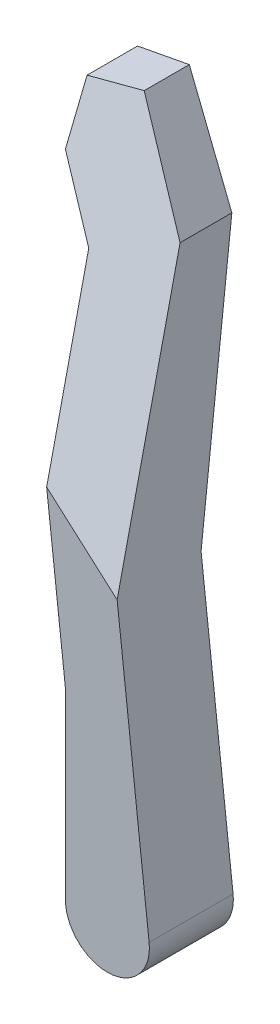
from build123d import *

# Parameters (mm, degrees)
EXTRUDE_START       = -3
EXTRUDE_1_DEPTH     = 8
EXTRUDE_2_DEPTH     = 8
CUT_EXTRUDE_2_DEPTH = 97.54987759


with BuildPart() as part:
    # 草图2 → 凸台-拉伸1 (new body)
    with BuildSketch(Plane.XY.offset(EXTRUDE_START)):
        with BuildLine():
            Line((3.974287423, 0.452812855), (-1.780163155, 50.958977377))
            Line((-1.780163155, 50.958977377), (-7, 60))
            Line((-7, 60), (-11, 60))
            Line((-11, 60), (-11, 54.92820323))
            Line((-11, 54.92820323), (-7.600316475, 49.039778636))
            Line((-7.600316475, 49.039778636), (-4, 17.440206483))
            Line((-4, 17.440206483), (-4, 0))
            ThreePointArc((-4, 0), (0.22677115, -3.993566682), (3.974287423, 0.452812855))
        make_face()
    extrude(amount=-EXTRUDE_1_DEPTH)

    # 草图4 → 凸台-拉伸2 (add)
    with BuildSketch(Plane(origin=(0, 0, -11), x_dir=(-1, 0, 0), z_dir=(0, 0, -1))):
        Polygon((1.780163155, 50.958977377), (-0.926709618, 27.201059955), (5.789070951, 33.142680696), (7.600316475, 49.039778636), (11, 54.92820323), (11, 60), (7, 60), align=None)
    extrude(amount=EXTRUDE_2_DEPTH)

    # 草图5 → 切除-拉伸2 (cut, through all, along a direction that is not the sketch's normal)
    with BuildSketch(Plane(origin=(3.974287423, 0.452812855, 0), x_dir=(0, 0, -1), z_dir=(0.9935718556765883, 0.11320321376789995, 0))):
        Polygon((11, 26.921301109), (19, 60.859546692), (19, 26.921301109), align=None)
        Polygon((15.352511196, 60.859546692), (3, 26.921301109), (3, 60.859546692), align=None)
    extrude(amount=-CUT_EXTRUDE_2_DEPTH, dir=(0.7489557207889941, -0.6626200482157467, 0), mode=Mode.SUBTRACT)


solid = part.part
